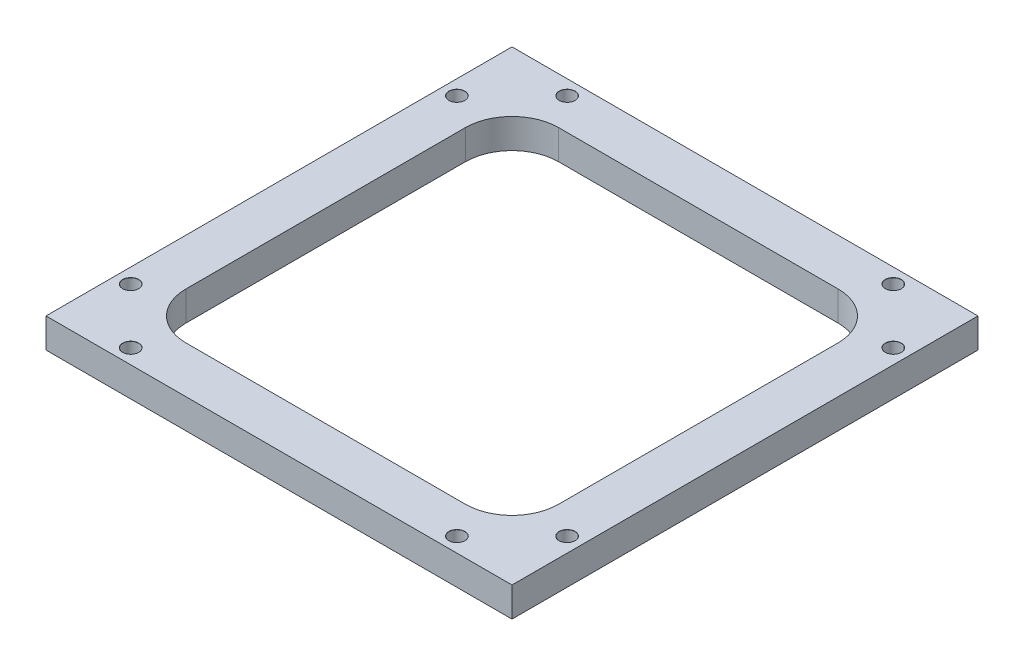
from build123d import *

# Parameters (mm, degrees)
SKETCH1_W                      = 100
SKETCH1_H                      = 100
BOSS_EXTRUDE3_DEPTH            = 6.35
M3_CLEARANCE_HOLE1_D           = 3.4
M3_CLEARANCE_HOLE1_CSINK_D     = 3.45
M3_CLEARANCE_HOLE1_CSINK_ANGLE = 90
CUT_EXTRUDE1_DEPTH             = 10


with BuildPart() as part:
    # Sketch1 → Boss-Extrude3 (new body)
    with BuildSketch(Plane(origin=(0, 0, 0), x_dir=(1, 0, 0), z_dir=(0, 1, 0))):
        Rectangle(SKETCH1_W, SKETCH1_H)
    extrude(amount=BOSS_EXTRUDE3_DEPTH)

    # M3 Clearance Hole1 (through all)
    with Locations(Plane(origin=(0, 6.35, 0), x_dir=(1, 0, 0), z_dir=(0, 1, 0))):
        with Locations((-46.825, 35), (-35, 46.825), (35, 46.825), (46.825, 35), (46.825, -35), (35, -46.825), (-35, -46.825), (-46.825, -35)):
            CounterSinkHole(M3_CLEARANCE_HOLE1_D / 2, M3_CLEARANCE_HOLE1_CSINK_D / 2, counter_sink_angle=M3_CLEARANCE_HOLE1_CSINK_ANGLE)

    # Sketch19 → Cut-Extrude1 (cut)
    with BuildSketch(Plane(origin=(0, 6.35, 0), x_dir=(1, 0, 0), z_dir=(0, 1, 0))):
        with BuildLine():
            Line((-30, -40), (30, -40))
            ThreePointArc((30, -40), (37.071067812, -37.071067812), (40, -30))
            Line((40, -30), (40, 30))
            ThreePointArc((40, 30), (37.071067812, 37.071067812), (30, 40))
            Line((30, 40), (-30, 40))
            ThreePointArc((-30, 40), (-37.071067812, 37.071067812), (-40, 30))
            Line((-40, 30), (-40, -30))
            ThreePointArc((-40, -30), (-37.071067812, -37.071067812), (-30, -40))
        make_face()
    extrude(amount=-CUT_EXTRUDE1_DEPTH, mode=Mode.SUBTRACT)


solid = part.part
